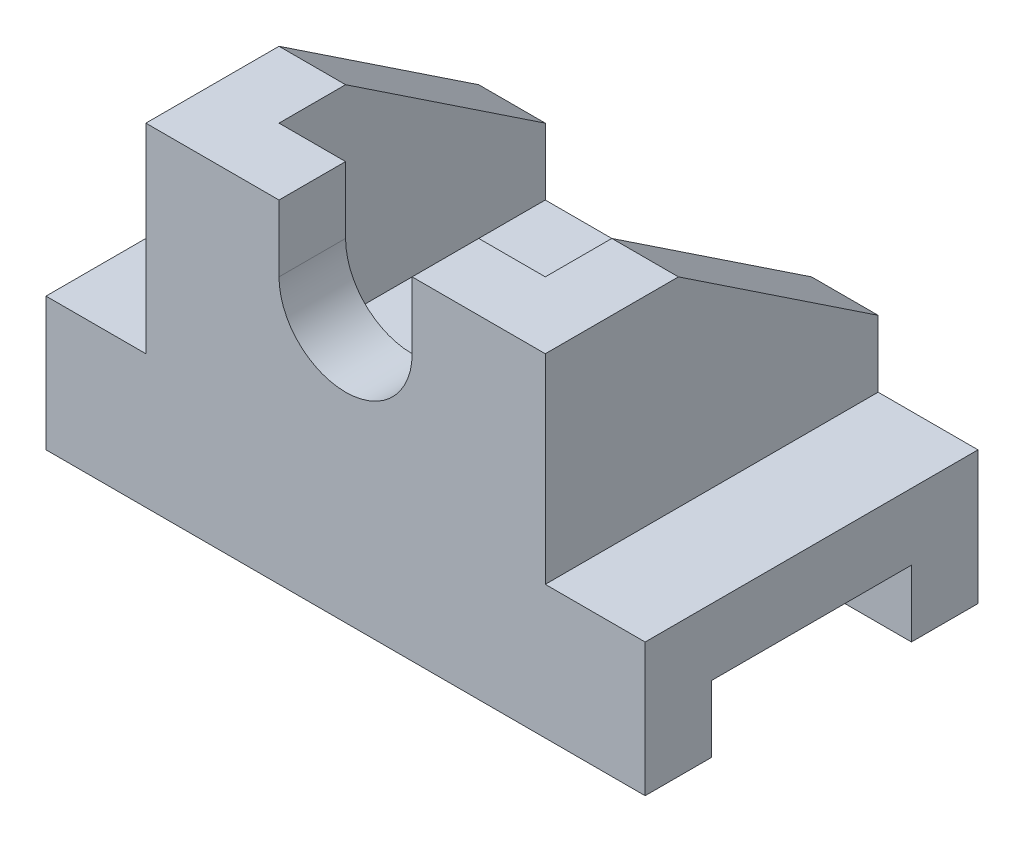
from build123d import *

# Parameters (mm, degrees)
SKETCH2_W           = 180
SKETCH2_H           = 100
BOSS_EXTRUDE2_DEPTH = 40
BOSS_EXTRUDE3_DEPTH = 60
SKETCH7_W           = 60
SKETCH7_H           = 40
CUT_EXTRUDE1_DEPTH  = 197.214168703
SKETCH15_W          = 80
SKETCH15_H          = 60
CUT_EXTRUDE2_DEPTH  = 80
CUT_EXTRUDE3_DEPTH  = 20
SKETCH20_R          = 20
CUT_EXTRUDE5_DEPTH  = 20


with BuildPart() as part:
    # Sketch2 → Boss-Extrude2 (new body)
    with BuildSketch(Plane(origin=(0, 0, 0), x_dir=(1, 0, 0), z_dir=(0, 1, 0))):
        Rectangle(SKETCH2_W, SKETCH2_H)
    extrude(amount=-BOSS_EXTRUDE2_DEPTH)

    # Sketch6 → Boss-Extrude3 (add, symmetric)
    with BuildSketch(Plane(origin=(0, 0, 0), x_dir=(0, 0, -1), z_dir=(1, 0, 0))):
        Polygon((50, 0), (50, 20), (-10, 60), (-50, 60), (-50, 0), align=None)
    extrude(amount=BOSS_EXTRUDE3_DEPTH, both=True)

    # Sketch7 → Cut-Extrude1 (cut, through all)
    with BuildSketch(Plane(origin=(90, 0, 0), x_dir=(0, 0, -1), z_dir=(1, 0, 0))):
        with Locations((0, -40)):
            Rectangle(SKETCH7_W, SKETCH7_H)
    extrude(amount=-CUT_EXTRUDE1_DEPTH, mode=Mode.SUBTRACT)

    # Sketch15 → Cut-Extrude2 (cut)
    with BuildSketch(Plane(origin=(0, 0, -50), x_dir=(-1, 0, 0), z_dir=(0, 0, -1))):
        with Locations((0, 30)):
            Rectangle(SKETCH15_W, SKETCH15_H)
    extrude(amount=-CUT_EXTRUDE2_DEPTH, mode=Mode.SUBTRACT)

    # Sketch16 → Cut-Extrude3 (cut)
    with BuildSketch(Plane(origin=(0, 0, 30), x_dir=(-1, 0, 0), z_dir=(0, 0, -1))):
        Polygon((20, 80), (-20, 80), (-20, 60), (1.28e-07, 60), (20, 60), align=None)
        with BuildLine():
            Line((1.28e-07, 60), (-20, 60))
            Line((-20, 60), (-20, 40))
            ThreePointArc((-20, 40), (-14.142135579, 54.142135669), (1.28e-07, 60))
        make_face()
        with BuildLine():
            ThreePointArc((1.28e-07, 60), (-14.142135579, 54.142135669), (-20, 40))
            Line((-20, 40), (20, 40))
            ThreePointArc((20, 40), (14.142135669, 54.142135579), (1.28e-07, 60))
        make_face()
        with BuildLine():
            Line((20, 40), (-20, 40))
            ThreePointArc((-20, 40), (0, 20), (20, 40))
        make_face()
        with BuildLine():
            Line((20, 40), (20, 60))
            Line((20, 60), (1.28e-07, 60))
            ThreePointArc((1.28e-07, 60), (14.142135669, 54.142135579), (20, 40))
        make_face()
    extrude(amount=-CUT_EXTRUDE3_DEPTH, mode=Mode.SUBTRACT)

    # Sketch20 → Cut-Extrude5 (cut)
    with BuildSketch(Plane(origin=(0, 0, 0), x_dir=(1, 0, 0), z_dir=(0, 1, 0))):
        with Locations(Location((0, 10, 0), (0, 0, 180))):
            Circle(SKETCH20_R)
    extrude(amount=-CUT_EXTRUDE5_DEPTH, mode=Mode.SUBTRACT)


solid = part.part
